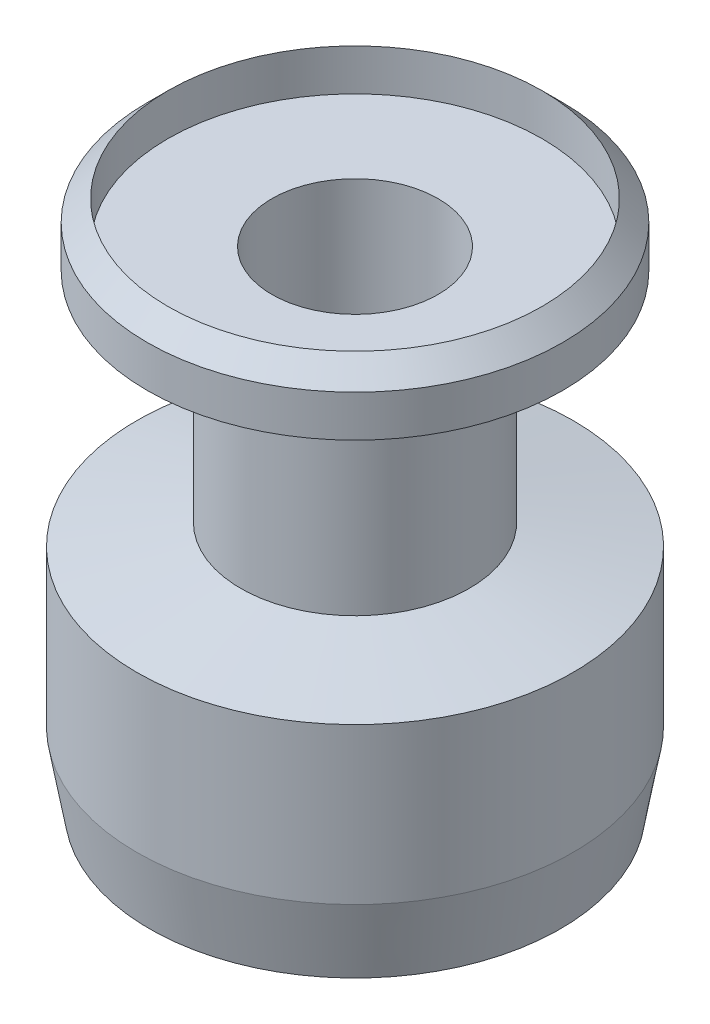
from build123d import *


with BuildPart() as part:
    # Sketch1 → Revolve1 (revolve)
    with BuildSketch(Plane.XY, mode=Mode.PRIVATE) as revolve1_sk:
        Polygon((20, 49), (20, 45), (11, 43), (11, 24), (21, 22), (21, 7), (19.765711135, 0), (19, 0), (19, 20), (8, 20), (8, 31), (2, 31), (2, 33), (4, 33), (4, 35.5), (8, 35.5), (8, 47), (18, 47), (18, 51), align=None)
    revolve(revolve1_sk.sketch.rotate(Axis((0, 0, 0), (0, 1, 0)), 90), axis=Axis((0, 0, 0), (0, 1, 0)))


solid = part.part
